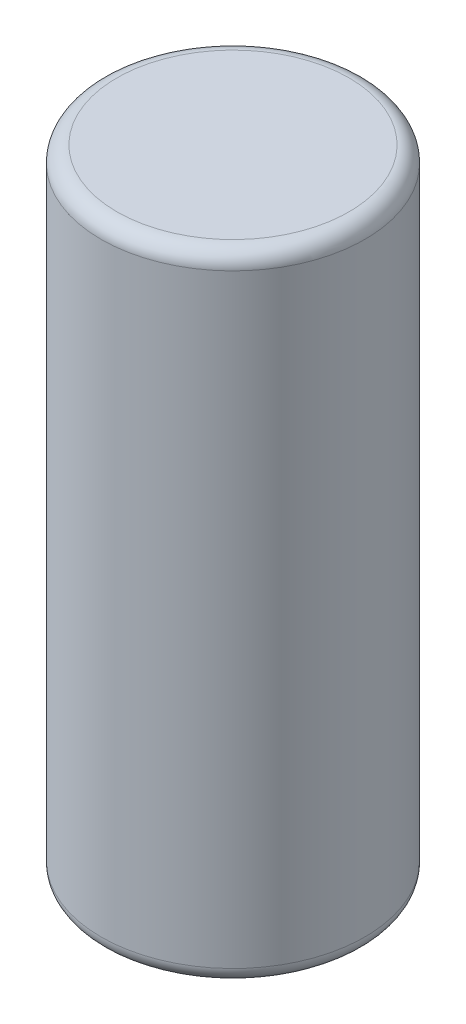
from build123d import *

# Parameters (mm, degrees)
SKETCH1_R           = 4.15
BOSS_EXTRUDE1_DEPTH = 20
FILLET1_R           = 0.5


with BuildPart() as part:
    # Sketch1 → Boss-Extrude1 (new body)
    with BuildSketch(Plane(origin=(0, 0, 0), x_dir=(1, 0, 0), z_dir=(0, 1, 0))):
        with Locations(Location((0, 0, 0), (0, 0, 270))):
            Circle(SKETCH1_R)
    extrude(amount=BOSS_EXTRUDE1_DEPTH)

    # Fillet1
    fillet1_edges = [part.edges().sort_by_distance(p)[0] for p in [
        (0, 0, -4.15),
        (0, 20, -4.15),
    ]]
    fillet(fillet1_edges, radius=FILLET1_R)


solid = part.part
